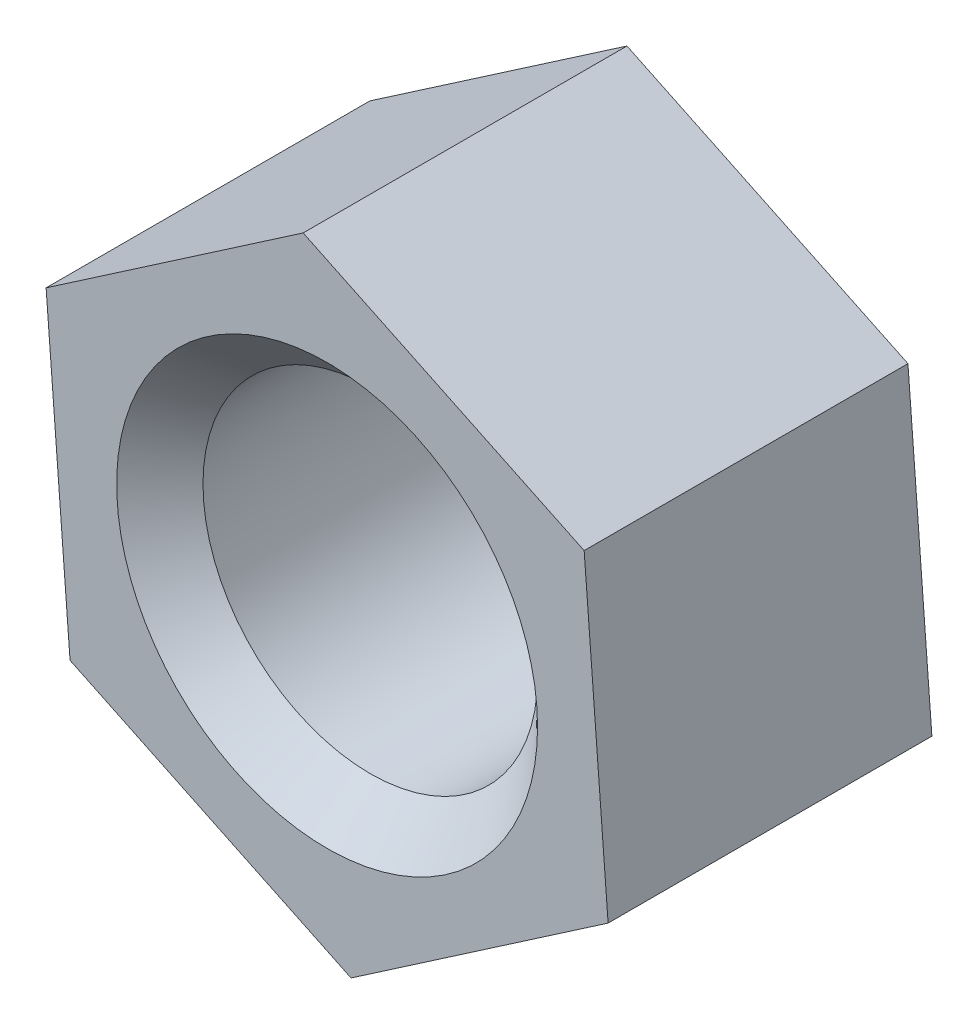
from build123d import *

# Parameters (mm, degrees)
BOSS_EXTRUDE1_DEPTH = 15
SKETCH2_R           = 7.75
CUT_EXTRUDE1_DEPTH  = 25.526787522
CHAMFER1_SIZE       = 2


with BuildPart() as part:
    # Sketch1 → Boss-Extrude1 (new body)
    with BuildSketch(Plane.XY):
        Polygon((13.017705446, -6.234795766), (11.908344244, 8.156265732), (-1.109361202, 14.391061499), (-13.017705446, 6.234795766), (-11.908344244, -8.156265732), (1.109361202, -14.391061499), align=None)
    extrude(amount=BOSS_EXTRUDE1_DEPTH)

    # Sketch2 → Cut-Extrude1 (cut, through all)
    with BuildSketch(Plane(origin=(0, 0, 0), x_dir=(-1, 0, 0), z_dir=(0, 0, -1))):
        Circle(SKETCH2_R)
    extrude(amount=-CUT_EXTRUDE1_DEPTH, mode=Mode.SUBTRACT)

    # Chamfer1
    chamfer1_edges = [part.edges().sort_by_distance(p)[0] for p in [
        (7.75, 0, 15),
        (7.75, 0, 0),
    ]]
    chamfer(chamfer1_edges, length=CHAMFER1_SIZE)


solid = part.part
